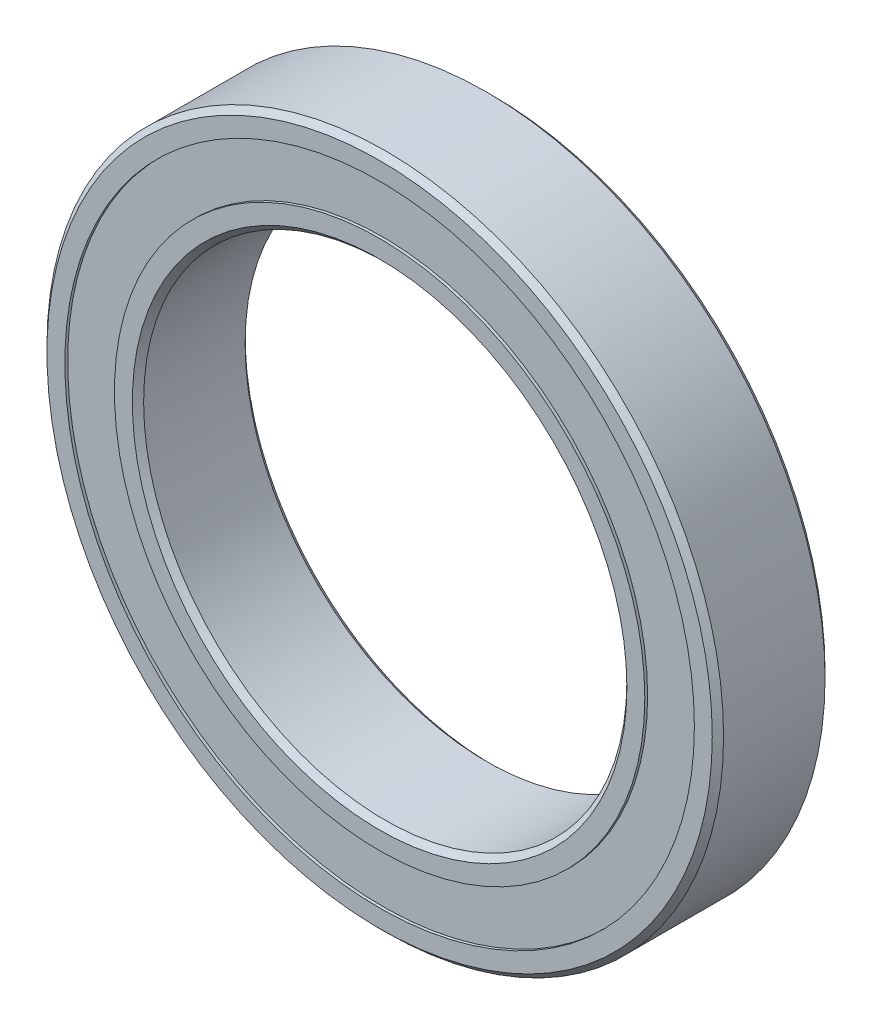
from build123d import *

# Parameters (mm, degrees)
CIRPATTERN1_COUNT = 12
SKETCH5_W         = 1.137166142
SKETCH5_H         = 3.076923076


with BuildPart() as part:
    # Sketch1 → Revolve1 (revolve)
    with BuildSketch(Plane(origin=(0, 0, 0), x_dir=(0, 0, -1), z_dir=(1, 0, 0))):
        with BuildLine():
            Line((3.15, 21), (-3.15, 21))
            Line((-3.15, 21), (-3.5, 20.65))
            Line((-3.5, 20.65), (-3.5, 19.538461538))
            Line((-3.5, 19.538461538), (-1.555555556, 19.538461538))
            ThreePointArc((-1.555555556, 19.538461538), (0, 20.187833858), (1.555555556, 19.538461538))
            Line((1.555555556, 19.538461538), (3.5, 19.538461538))
            Line((3.5, 19.538461538), (3.5, 20.65))
            Line((3.5, 20.65), (3.15, 21))
        make_face()
    revolve(axis=Axis((0, 0, 3.5), (0, 0, -1)))


with BuildPart() as body_2:
    # Sketch3 → Revolve3 (revolve)
    with BuildSketch(Plane(origin=(0, 0, 0), x_dir=(0, 0, -1), z_dir=(1, 0, 0))):
        with BuildLine():
            Line((-3.5, 16.461538462), (-1.555555556, 16.461538462))
            ThreePointArc((-1.555555556, 16.461538462), (0, 15.812166142), (1.555555556, 16.461538462))
            Line((1.555555556, 16.461538462), (3.5, 16.461538462))
            Line((3.5, 16.461538462), (3.5, 15.35))
            Line((3.5, 15.35), (3.15, 15))
            Line((3.15, 15), (-3.15, 15))
            Line((-3.15, 15), (-3.5, 15.35))
            Line((-3.5, 15.35), (-3.5, 16.461538462))
        make_face()
    revolve(axis=Axis((0, 0, 3.5), (0, 0, -1)))


with BuildPart() as body_3:
    # Sketch4 → Revolve4 (revolve)
    with BuildSketch(Plane(origin=(0, 0, 0), x_dir=(0, 0, -1), z_dir=(1, 0, 0))):
        with BuildLine():
            Line((-2.187833858, 18), (2.187833858, 18))
            ThreePointArc((2.187833858, 18), (0, 20.187833858), (-2.187833858, 18))
        make_face()
    revolve(axis=Axis((0, 18, 2.187833858), (0, 0, -1)))


with BuildPart() as cirpattern1_1:
    # CirPattern1: pattern copy
    add(body_3.part.rotate(Axis((0, 0, -3.5), (0, 0, 1)), 1 * 360 / CIRPATTERN1_COUNT))


with BuildPart() as cirpattern1_2:
    # CirPattern1: pattern copy
    add(body_3.part.rotate(Axis((0, 0, -3.5), (0, 0, 1)), 2 * 360 / CIRPATTERN1_COUNT))


with BuildPart() as cirpattern1_3:
    # CirPattern1: pattern copy
    add(body_3.part.rotate(Axis((0, 0, -3.5), (0, 0, 1)), 3 * 360 / CIRPATTERN1_COUNT))


with BuildPart() as cirpattern1_4:
    # CirPattern1: pattern copy
    add(body_3.part.rotate(Axis((0, 0, -3.5), (0, 0, 1)), 4 * 360 / CIRPATTERN1_COUNT))


with BuildPart() as cirpattern1_5:
    # CirPattern1: pattern copy
    add(body_3.part.rotate(Axis((0, 0, -3.5), (0, 0, 1)), 5 * 360 / CIRPATTERN1_COUNT))


with BuildPart() as cirpattern1_6:
    # CirPattern1: pattern copy
    add(body_3.part.rotate(Axis((0, 0, -3.5), (0, 0, 1)), 6 * 360 / CIRPATTERN1_COUNT))


with BuildPart() as cirpattern1_7:
    # CirPattern1: pattern copy
    add(body_3.part.rotate(Axis((0, 0, -3.5), (0, 0, 1)), 7 * 360 / CIRPATTERN1_COUNT))


with BuildPart() as cirpattern1_8:
    # CirPattern1: pattern copy
    add(body_3.part.rotate(Axis((0, 0, -3.5), (0, 0, 1)), 8 * 360 / CIRPATTERN1_COUNT))


with BuildPart() as cirpattern1_9:
    # CirPattern1: pattern copy
    add(body_3.part.rotate(Axis((0, 0, -3.5), (0, 0, 1)), 9 * 360 / CIRPATTERN1_COUNT))


with BuildPart() as cirpattern1_10:
    # CirPattern1: pattern copy
    add(body_3.part.rotate(Axis((0, 0, -3.5), (0, 0, 1)), 10 * 360 / CIRPATTERN1_COUNT))


with BuildPart() as cirpattern1_11:
    # CirPattern1: pattern copy
    add(body_3.part.rotate(Axis((0, 0, -3.5), (0, 0, 1)), 11 * 360 / CIRPATTERN1_COUNT))


with BuildPart() as body_15:
    # Sketch5 → Revolve5 (revolve)
    with BuildSketch(Plane(origin=(0, 0, 0), x_dir=(0, 0, -1), z_dir=(1, 0, 0))):
        with Locations((-2.756416929, 18)):
            Rectangle(SKETCH5_W, SKETCH5_H)
        with Locations((2.756416929, 18)):
            Rectangle(SKETCH5_W, SKETCH5_H)
    revolve(axis=Axis((0, 0, 3.5), (0, 0, -1)))


solid = Compound([part.part, body_2.part, body_3.part, cirpattern1_1.part, cirpattern1_2.part, cirpattern1_3.part, cirpattern1_4.part, cirpattern1_5.part, cirpattern1_6.part, cirpattern1_7.part, cirpattern1_8.part, cirpattern1_9.part, cirpattern1_10.part, cirpattern1_11.part, body_15.part])
